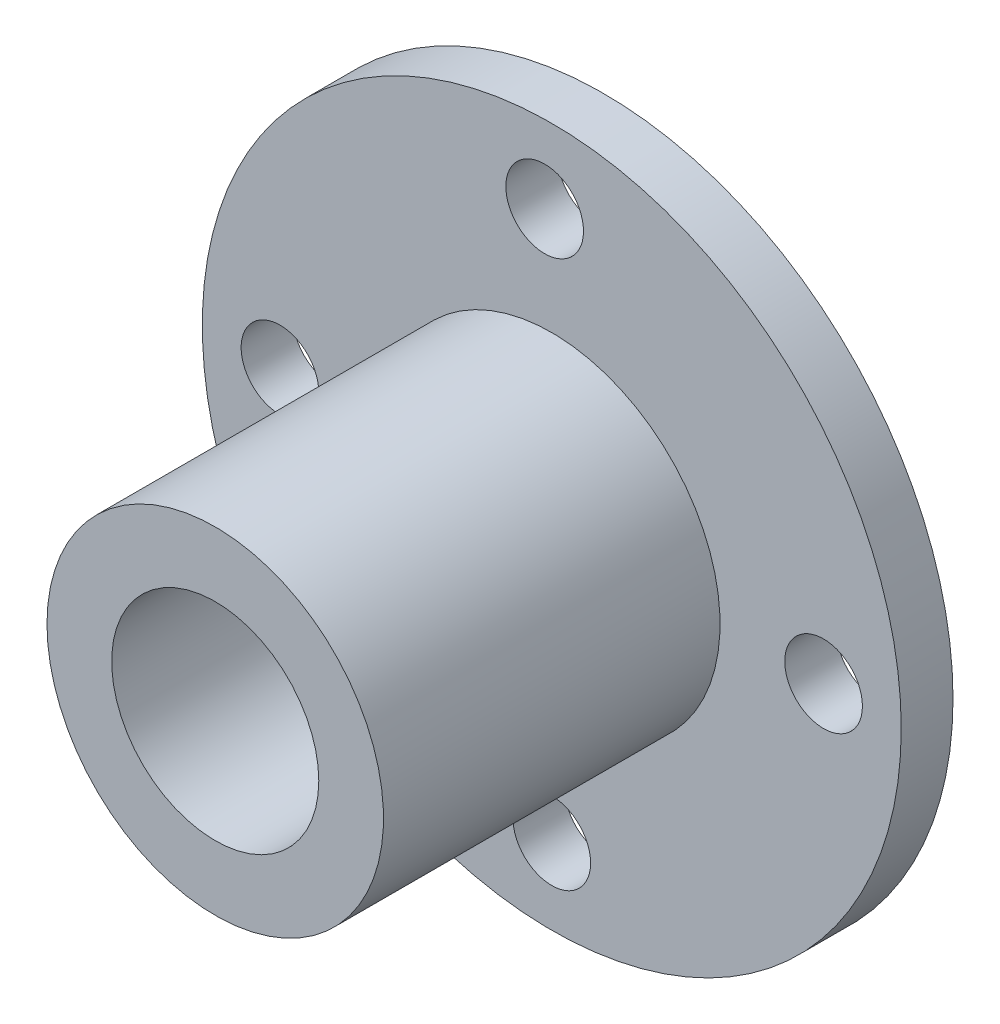
from build123d import *

# Parameters (mm, degrees)
SKETCH_1_R          = 13.5
EXTRUDE_1_DEPTH     = 2
SKETCH_2_R          = 6.5
EXTRUDE_2_DEPTH     = 13
SKETCH_3_R          = 4
CUT_EXTRUDE_1_DEPTH = 15
SKETCH_4_R          = 1.5
CUT_EXTRUDE_2_DEPTH = 15


with BuildPart() as part:
    # 草图1 → 凸台-拉伸1 (new body)
    with BuildSketch(Plane.XY):
        Circle(SKETCH_1_R)
    extrude(amount=EXTRUDE_1_DEPTH)

    # 草图2 → 凸台-拉伸2 (add)
    with BuildSketch(Plane.XY.offset(2)):
        with Locations(Location((0, 0, 0), (0, 0, 180))):
            Circle(SKETCH_2_R)
    extrude(amount=EXTRUDE_2_DEPTH)

    # 草图3 → 切除-拉伸1 (cut)
    with BuildSketch(Plane.XY.offset(15)):
        Circle(SKETCH_3_R)
    extrude(amount=-CUT_EXTRUDE_1_DEPTH, mode=Mode.SUBTRACT)

    # 草图4 → 切除-拉伸2 (cut)
    with BuildSketch(Plane.XY.offset(2)):
        with Locations((-10.5, 0)):
            Circle(SKETCH_4_R)
        with Locations((-0.274707959, 10.5)):
            Circle(SKETCH_4_R)
        with Locations((10.5, 0)):
            Circle(SKETCH_4_R)
        with Locations((0, -10.5)):
            Circle(SKETCH_4_R)
    extrude(amount=-CUT_EXTRUDE_2_DEPTH, mode=Mode.SUBTRACT)


solid = part.part
